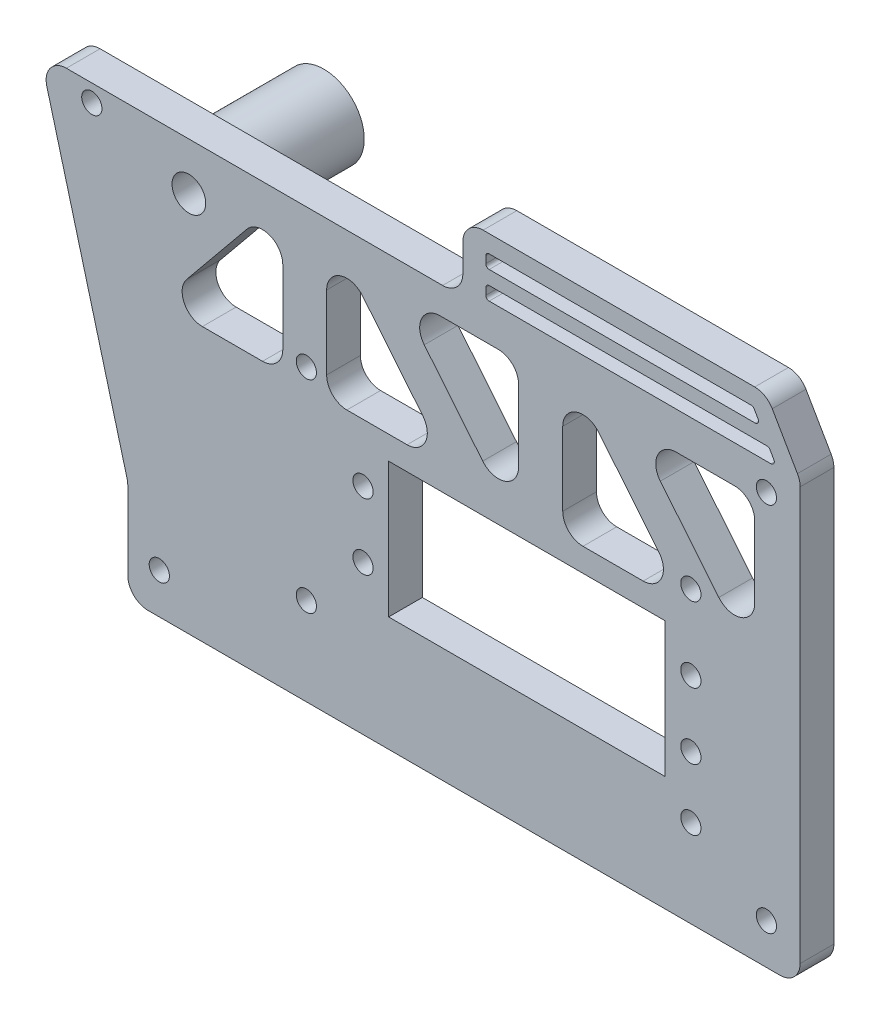
from build123d import *

# Parameters (mm, degrees)
SKETCH_1_R          = 1.5
SKETCH_1_W          = 41
SKETCH_1_H          = 20
EXTRUDE_1_DEPTH     = 5
SKETCH_2_R          = 6
SKETCH_2_R_2        = 4
EXTRUDE_2_DEPTH     = 15
CUT_EXTRUDE_1_REACH = 77.573
SKETCH_3_R          = 2.5


with BuildPart() as part:
    # 草图1 → 凸台-拉伸1 (new body)
    with BuildSketch(Plane.XY):
        with BuildLine():
            Line((50.475318096, 32.112170347), (50.475318096, -29.083982076))
            ThreePointArc((50.475318096, -29.083982076), (49.59663844, -31.205302419), (47.475318096, -32.083982076))
            Line((47.475318096, -32.083982076), (-46.199426394, -32.083982076))
            ThreePointArc((-46.199426394, -32.083982076), (-48.320746738, -31.205302419), (-49.199426394, -29.083982076))
            Line((-49.199426394, -29.083982076), (-49.199426394, -17.478939569))
            ThreePointArc((-49.199426394, -17.478939569), (-49.22509181, -17.087360992), (-49.301648916, -16.702482433))
            Line((-49.301648916, -16.702482433), (-61.198360071, 27.696648043))
            ThreePointArc((-61.198360071, 27.696648043), (-60.680642613, 30.299389465), (-58.300582592, 31.473105178))
            Line((-58.300582592, 31.473105178), (-2.524681904, 31.473105178))
            ThreePointArc((-2.524681904, 31.473105178), (-0.40336156, 32.351784835), (0.475318096, 34.473105178))
            Line((0.475318096, 34.473105178), (0.475318096, 38.576271962))
            ThreePointArc((0.475318096, 38.576271962), (1.353997752, 40.697592306), (3.475318096, 41.576271962))
            Line((3.475318096, 41.576271962), (43.743267288, 41.576271962))
            ThreePointArc((43.743267288, 41.576271962), (45.243267288, 41.174348173), (46.3413435, 40.076271962))
            Line((46.3413435, 40.076271962), (50.073394307, 33.612170347))
            ThreePointArc((50.073394307, 33.612170347), (50.373095575, 32.888627482), (50.475318096, 32.112170347))
        make_face()
        with Locations((34.275318096, -0.183982076)):
            Circle(SKETCH_1_R, mode=Mode.SUBTRACT)
        with Locations((34.275318096, -9.983982076)):
            Circle(SKETCH_1_R, mode=Mode.SUBTRACT)
        with Locations(Location((-14.324681904, -9.983982076, 0), (0, 0, 180))):
            Circle(SKETCH_1_R, mode=Mode.SUBTRACT)
        with Locations(Location((-14.324681904, -0.183982076, 0), (0, 0, 180))):
            Circle(SKETCH_1_R, mode=Mode.SUBTRACT)
        with Locations((45.475318096, -26.083982076)):
            Circle(SKETCH_1_R, mode=Mode.SUBTRACT)
        with Locations((45.475318096, 28.916017924)):
            Circle(SKETCH_1_R, mode=Mode.SUBTRACT)
        with Locations((-44.524681904, -26.083982076)):
            Circle(SKETCH_1_R, mode=Mode.SUBTRACT)
        with Locations((-54.524681904, 28.916017924)):
            Circle(SKETCH_1_R, mode=Mode.SUBTRACT)
        with Locations((34.275318096, 10.916017924)):
            Circle(SKETCH_1_R, mode=Mode.SUBTRACT)
        with Locations((-22.724681904, 10.916017924)):
            Circle(SKETCH_1_R, mode=Mode.SUBTRACT)
        with Locations((34.275318096, -19.083982076)):
            Circle(SKETCH_1_R, mode=Mode.SUBTRACT)
        with Locations((-22.724681904, -19.083982076)):
            Circle(SKETCH_1_R, mode=Mode.SUBTRACT)
        with Locations((9.975318096, -5.083982076)):
            Rectangle(SKETCH_1_W, SKETCH_1_H, mode=Mode.SUBTRACT)
        with BuildLine():
            Line((43.743267288, 24.388896624), (43.743267288, 13.793120092))
            ThreePointArc((43.743267288, 13.793120092), (41.751826733, 10.967733774), (38.421395391, 11.893406721))
            Line((38.421395391, 11.893406721), (29.752123683, 22.489183253))
            ThreePointArc((29.752123683, 22.489183253), (29.362986533, 25.673587226), (32.07399558, 27.388896624))
            Line((32.07399558, 27.388896624), (40.743267288, 27.388896624))
            ThreePointArc((40.743267288, 27.388896624), (42.864587632, 26.510216968), (43.743267288, 24.388896624))
        make_face(mode=Mode.SUBTRACT)
        with BuildLine():
            Line((27.205627867, 8.388896624), (18.282890218, 8.388896624))
            ThreePointArc((18.282890218, 8.388896624), (16.161569875, 9.26757628), (15.282890218, 11.388896624))
            Line((15.282890218, 11.388896624), (15.282890218, 22.294464861))
            ThreePointArc((15.282890218, 22.294464861), (17.274330774, 25.11985118), (20.604762116, 24.194178232))
            Line((20.604762116, 24.194178232), (29.527499765, 13.288609995))
            ThreePointArc((29.527499765, 13.288609995), (29.916636915, 10.104206022), (27.205627867, 8.388896624))
        make_face(mode=Mode.SUBTRACT)
        with BuildLine():
            Line((-2.92600442, 27.388896624), (5.743267288, 27.388896624))
            ThreePointArc((5.743267288, 27.388896624), (7.864587632, 26.510216968), (8.743267288, 24.388896624))
            Line((8.743267288, 24.388896624), (8.743267288, 13.793120092))
            ThreePointArc((8.743267288, 13.793120092), (6.751826733, 10.967733774), (3.421395391, 11.893406721))
            Line((3.421395391, 11.893406721), (-5.247876317, 22.489183253))
            ThreePointArc((-5.247876317, 22.489183253), (-5.637013467, 25.673587226), (-2.92600442, 27.388896624))
        make_face(mode=Mode.SUBTRACT)
        with BuildLine():
            Line((-7.794372133, 8.388896624), (-16.717109782, 8.388896624))
            ThreePointArc((-16.717109782, 8.388896624), (-18.838430125, 9.26757628), (-19.717109782, 11.388896624))
            Line((-19.717109782, 11.388896624), (-19.717109782, 22.294464861))
            ThreePointArc((-19.717109782, 22.294464861), (-17.725669226, 25.11985118), (-14.395237884, 24.194178232))
            Line((-14.395237884, 24.194178232), (-5.472500235, 13.288609995))
            ThreePointArc((-5.472500235, 13.288609995), (-5.083363085, 10.104206022), (-7.794372133, 8.388896624))
        make_face(mode=Mode.SUBTRACT)
        with BuildLine():
            Line((-38.13984743, 8.388896624), (-29.217109782, 8.388896624))
            ThreePointArc((-29.217109782, 8.388896624), (-27.095789438, 9.26757628), (-26.217109782, 11.388896624))
            Line((-26.217109782, 11.388896624), (-26.217109782, 22.294464861))
            ThreePointArc((-26.217109782, 22.294464861), (-28.208550337, 25.11985118), (-31.538981679, 24.194178232))
            Line((-31.538981679, 24.194178232), (-40.461719328, 13.288609995))
            ThreePointArc((-40.461719328, 13.288609995), (-40.850856478, 10.104206022), (-38.13984743, 8.388896624))
        make_face(mode=Mode.SUBTRACT)
        with BuildLine():
            Line((43.656664748, 38.726271962), (44.234015017, 37.726271962))
            ThreePointArc((44.234015017, 37.726271962), (44.234015017, 37.226271962), (43.801002315, 36.976271962))
            Line((43.801002315, 36.976271962), (4.377241885, 36.976271962))
            ThreePointArc((4.377241885, 36.976271962), (4.023688494, 37.122718571), (3.877241885, 37.476271962))
            Line((3.877241885, 37.476271962), (3.877241885, 38.476271962))
            ThreePointArc((3.877241885, 38.476271962), (4.023688494, 38.829825353), (4.377241885, 38.976271962))
            Line((4.377241885, 38.976271962), (43.223652046, 38.976271962))
            ThreePointArc((43.223652046, 38.976271962), (43.473652046, 38.909284664), (43.656664748, 38.726271962))
        make_face(mode=Mode.SUBTRACT)
        with BuildLine():
            Line((45.567840808, 34.916017924), (4.377241885, 34.916017924))
            ThreePointArc((4.377241885, 34.916017924), (4.023688494, 34.769571315), (3.877241885, 34.416017924))
            Line((3.877241885, 34.416017924), (3.877241885, 33.416017924))
            ThreePointArc((3.877241885, 33.416017924), (4.023688494, 33.062464534), (4.377241885, 32.916017924))
            Line((4.377241885, 32.916017924), (46.145191077, 32.916017924))
            ThreePointArc((46.145191077, 32.916017924), (46.578203779, 33.166017924), (46.578203779, 33.666017924))
            Line((46.578203779, 33.666017924), (46.00085351, 34.666017924))
            ThreePointArc((46.00085351, 34.666017924), (45.817840808, 34.849030626), (45.567840808, 34.916017924))
        make_face(mode=Mode.SUBTRACT)
    extrude(amount=EXTRUDE_1_DEPTH)

    # 草图2 → 凸台-拉伸2 (add)
    with BuildSketch(Plane(origin=(0, 0, 0), x_dir=(-1, 0, 0), z_dir=(0, 0, -1))):
        with Locations((40.140283875, 24.449081996)):
            Circle(SKETCH_2_R)
        with Locations((40.140283875, 24.449081996)):
            Circle(SKETCH_2_R_2, mode=Mode.SUBTRACT)
    extrude(amount=EXTRUDE_2_DEPTH)

    # 草图3 → 切除-拉伸1 (cut, up to next)
    with BuildSketch(Plane(origin=(0, 0, 0), x_dir=(-1, 0, 0), z_dir=(0, 0, -1)), mode=Mode.PRIVATE) as cut_extrude_1_sk1:
        with Locations((40.140283875, 24.449081996)):
            Circle(SKETCH_3_R)
    cut_extrude_1_tool1 = extrude(cut_extrude_1_sk1.sketch, amount=-CUT_EXTRUDE_1_REACH, mode=Mode.PRIVATE) & part.part
    add(cut_extrude_1_tool1.solids().sort_by_distance((-40.140284, 24.449082, 0))[0], mode=Mode.SUBTRACT)


solid = part.part
